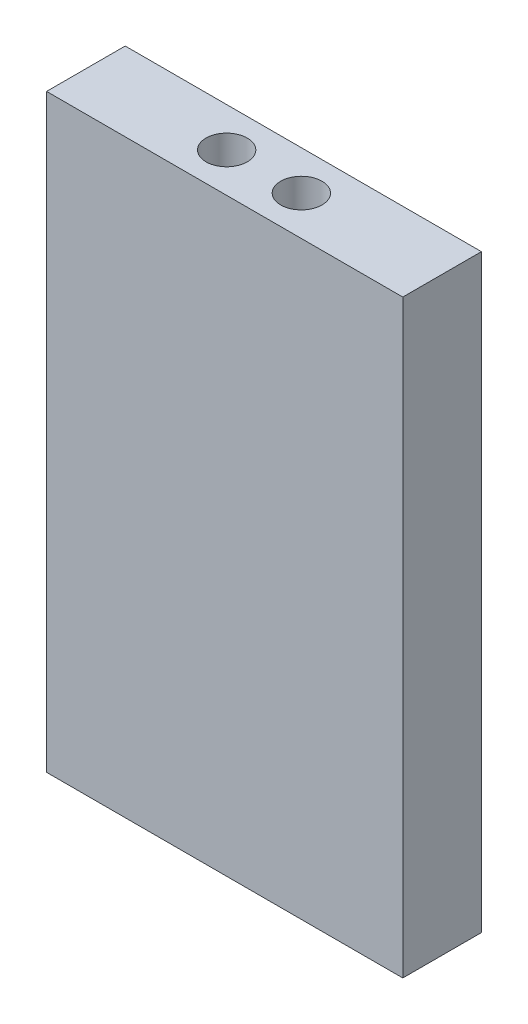
from build123d import *

# Parameters (mm, degrees)
SKETCH1_W           = 100
SKETCH1_H           = 150
BOSS_EXTRUDE1_DEPTH = 20
SKETCH2_R           = 5.25
CUT_EXTRUDE1_DEPTH  = 26
SKETCH3_W           = 4.7
SKETCH3_H           = 150
CUT_EXTRUDE2_DEPTH  = 20


with BuildPart() as part:
    # Sketch1 → Boss-Extrude1 (new body)
    with BuildSketch(Plane.XY):
        with Locations((-49.435028249, 17.09039548)):
            Rectangle(SKETCH1_W, SKETCH1_H)
    extrude(amount=BOSS_EXTRUDE1_DEPTH)

    # Sketch2 → Cut-Extrude1 (cut)
    with BuildSketch(Plane(origin=(0, 92.09039548, 0), x_dir=(1, 0, 0), z_dir=(0, 1, 0))):
        with Locations(Location((-58.935028249, -10, 0), (0, 0, 270))):
            Circle(SKETCH2_R)
        with Locations(Location((-39.935028249, -10, 0), (0, 0, 270))):
            Circle(SKETCH2_R)
    extrude(amount=-CUT_EXTRUDE1_DEPTH, mode=Mode.SUBTRACT)

    # Sketch3 → Cut-Extrude2 (cut)
    with BuildSketch(Plane.XY.offset(20)):
        with Locations((-97.085028249, 17.09039548)):
            Rectangle(SKETCH3_W, SKETCH3_H)
        with Locations((-1.785028249, 17.09039548)):
            Rectangle(SKETCH3_W, SKETCH3_H)
    extrude(amount=-CUT_EXTRUDE2_DEPTH, mode=Mode.SUBTRACT)


solid = part.part
